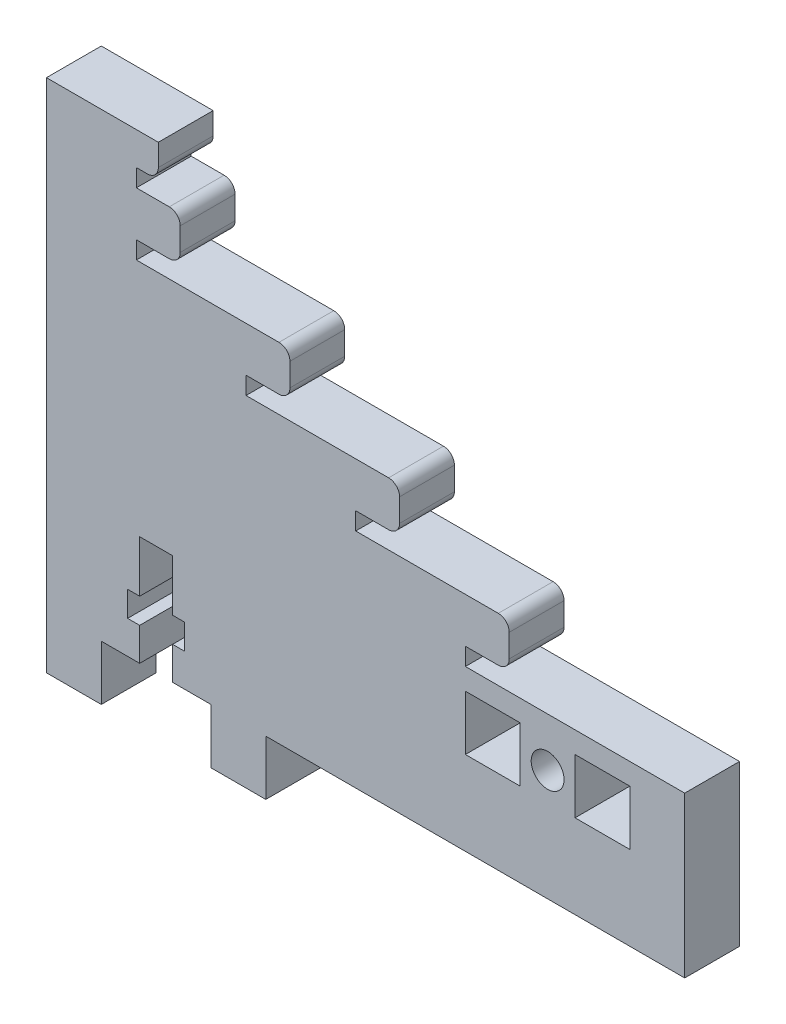
from build123d import *

# Parameters (mm, degrees)
SKETCH1_R           = 1.5
SKETCH1_W           = 5
SKETCH1_H           = 5
BOSS_EXTRUDE1_DEPTH = 5
FILLET3_R           = 1


with BuildPart() as part:
    # Sketch1 → Boss-Extrude1 (new body)
    with BuildSketch(Plane.XY):
        Polygon((0, 5), (0, 19.982808697), (0, 31), (0, 30.1), (0, 47), (10.2, 47), (10.2, 44), (8.2, 44), (8.2, 42.4), (12.2, 42.4), (12.2, 38.3), (8.2, 38.3), (8.2, 36.7), (22.2, 36.7), (22.2, 32.6), (18.2, 32.6), (18.2, 31), (32.2, 31), (32.2, 26.9), (28.2, 26.9), (28.2, 25.3), (42.2, 25.3), (42.2, 21.2), (38.2, 21.2), (38.2, 19.6), (58.2, 19.6), (58.2, 5), (20, 5), (20, 0), (15, 0), (15, 5), (11.5, 5), (11.5, 8), (12.6, 8), (12.6, 10.3), (11.5, 10.3), (11.5, 15), (8.5, 15), (8.5, 10.3), (7.4, 10.3), (7.4, 8), (8.5, 8), (8.5, 5), (5, 5), (5, 0), (0, 0), align=None)
        with Locations((45.7, 15.15)):
            Circle(SKETCH1_R, mode=Mode.SUBTRACT)
        with Locations((40.7, 15.15)):
            Rectangle(SKETCH1_W, SKETCH1_H, mode=Mode.SUBTRACT)
        with Locations((50.7, 15.15)):
            Rectangle(SKETCH1_W, SKETCH1_H, mode=Mode.SUBTRACT)
    extrude(amount=BOSS_EXTRUDE1_DEPTH)

    # Fillet3
    fillet3_edges = [part.edges().sort_by_distance(p)[0] for p in [
        (10.2, 44, 2.5),
        (12.2, 42.4, 2.5),
        (12.2, 38.3, 2.5),
        (22.2, 36.7, 2.5),
        (22.2, 32.6, 2.5),
        (32.2, 31, 2.5),
        (32.2, 26.9, 2.5),
        (42.2, 25.3, 2.5),
        (42.2, 21.2, 2.5),
    ]]
    fillet(fillet3_edges, radius=FILLET3_R)


solid = part.part
